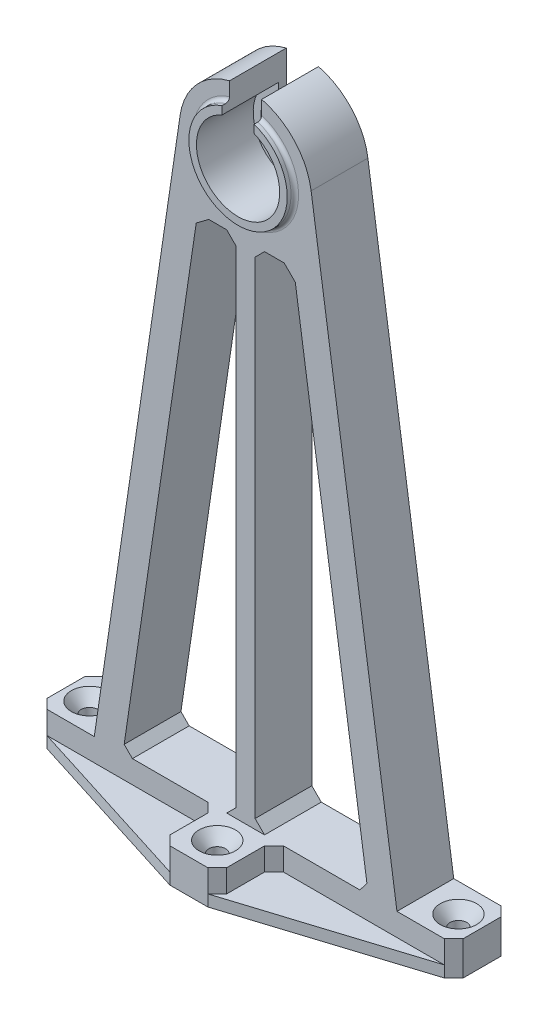
from build123d import *
from OCP.BRepFilletAPI import BRepFilletAPI_MakeChamfer

# Parameters (mm, degrees)
BOSS_EXTRUDE1_DEPTH     = 15
SKETCH4_W               = 15
SKETCH4_H               = 15
BOSS_EXTRUDE2_DEPTH     = 9
CUT_EXTRUDE1_DEPTH      = 180.279015807
CUT_EXTRUDE1_DEPTH_BACK = 180.279015807
SKETCH2_R               = 2.2
SKETCH3_W               = 4.807860213
SKETCH3_H               = 184.008472667
CHAMFER1_SIZE           = 2.5
CHAMFER1_SIZE2          = 2.965251078
CHAMFER1_SIZE2_2        = 2.201823595
CHAMFER2_SIZE           = 2.5
BOSS_EXTRUDE5_DEPTH     = 3
BOSS_EXTRUDE3_DEPTH     = 2
BOSS_EXTRUDE6_DEPTH     = 2
FILLET2_R               = 1


with BuildPart() as part:
    # Sketch1 → Boss-Extrude1 (new body)
    with BuildSketch(Plane.XY):
        with BuildLine():
            Line((4.25, 16.976086121), (4.25, 10.145811944))
            ThreePointArc((4.25, 10.145811944), (0, -11), (-4.25, 10.145811944))
            Line((-4.25, 10.145811944), (-4.25, 16.976086121))
            ThreePointArc((-4.25, 16.976086121), (-12.969277239, 11.74937649), (-17.312062276, 2.557831066))
            Line((-17.312062276, 2.557831066), (-40, -151))
            Line((-40, -151), (-55, -151))
            Line((-55, -151), (-55, -160))
            Line((-55, -160), (55, -160))
            Line((55, -160), (55, -151))
            Line((55, -151), (40, -151))
            Line((40, -151), (17.312062276, 2.557831066))
            ThreePointArc((17.312062276, 2.557831066), (12.969277239, 11.74937649), (4.25, 16.976086121))
        make_face()
        Polygon((12.694157412, -17.5), (32.418580877, -151), (2.5, -151), (2.5, -17.5), align=None, mode=Mode.SUBTRACT)
        Polygon((-12.694157412, -17.5), (-2.5, -17.5), (-2.5, -151), (-32.418580877, -151), align=None, mode=Mode.SUBTRACT)
    extrude(amount=BOSS_EXTRUDE1_DEPTH)

    # Sketch4 → Boss-Extrude2 (add)
    with BuildSketch(Plane.XZ.offset(160)):
        with Locations((0, 22.5)):
            Rectangle(SKETCH4_W, SKETCH4_H)
    extrude(amount=-BOSS_EXTRUDE2_DEPTH)

    # Sketch2 → Cut-Extrude1 (cut, two sides: drawn at the far end of the back side and taken through both)
    with BuildSketch(Plane(origin=(0, -151, 0), x_dir=(1, 0, 0), z_dir=(0, 1, 0)).offset(-CUT_EXTRUDE1_DEPTH_BACK)):
        with Locations(Location((-48.75, -7.5, 0), (0, 0, 180))):
            Circle(SKETCH2_R)
        with Locations(Location((48.75, -7.5, 0), (0, 0, 270))):
            Circle(SKETCH2_R)
        with Locations(Location((0, -22.5, 0), (0, 0, 180))):
            Circle(SKETCH2_R)
    extrude(amount=CUT_EXTRUDE1_DEPTH + CUT_EXTRUDE1_DEPTH_BACK, mode=Mode.SUBTRACT)

    # Sketch3 → Cut-Revolve2 (revolve, cut)
    with BuildSketch(Plane(origin=(-48.75, 0, 0), x_dir=(0, 0, -1), z_dir=(1, 0, 0)), mode=Mode.PRIVATE) as cut_revolve2_sk:
        with Locations((-5.096069894, -58.995763666)):
            Rectangle(SKETCH3_W, SKETCH3_H)
        Polygon((-5.3, -154), (-2.692139787, -151), (-7.5, -151), (-7.5, -154), align=None)
    cut_revolve2 = revolve(cut_revolve2_sk.sketch.rotate(Axis((-48.75, -151, 7.5), (0, -1, 0)), 270), axis=Axis((-48.75, -151, 7.5), (0, -1, 0)), mode=Mode.SUBTRACT)

    # Sketch5 → Cut-Revolve3 (revolve, cut)
    with BuildSketch(Plane(origin=(0, 0, 0), x_dir=(0, 0, -1), z_dir=(1, 0, 0)), mode=Mode.PRIVATE) as cut_revolve3_sk:
        Polygon((-22.5, -151), (-22.5, -154), (-20.3, -154), (-17.692139787, -151), align=None)
    revolve(cut_revolve3_sk.sketch.rotate(Axis((0, -151, 22.5), (0, -1, 0)), 270), axis=Axis((0, -151, 22.5), (0, -1, 0)), mode=Mode.SUBTRACT)

    # Mirror1: Cut-Revolve2 across plane
    add(cut_revolve2.mirror(Plane(origin=(0, 0, 0), x_dir=(0, 0, 1), z_dir=(1, 0, 0))), mode=Mode.SUBTRACT)

    # Chamfer1: one chamfer whose edges measure the first distance from different faces: ONE call of the kernel's chamfer builder (chamfer() names one face for all edges)
    chamfer1_edges_1 = [part.edges().sort_by_distance(p)[0] for p in [
        (-2.5, -17.5, 7.5),
        (-2.5, -151, 7.5),
        (2.5, -151, 7.5),
        (2.5, -17.5, 7.5),
    ]]
    chamfer1_edges_2 = [part.edges().sort_by_distance(p)[0] for p in [
        (-12.694157412, -17.5, 7.5),
    ]]
    chamfer1_side_2 = [part.faces().sort_by_distance(p)[0] for p in [
        (-22.556369145, -84.25, 7.5),
    ]]
    chamfer1_edges_3 = [part.edges().sort_by_distance(p)[0] for p in [
        (-32.418580877, -151, 7.5),
    ]]
    chamfer1_side_3 = [part.faces().sort_by_distance(p)[0] for p in [
        (31.704168003, -151, 7.5),
    ]]
    chamfer1_edges_4 = [part.edges().sort_by_distance(p)[0] for p in [
        (32.418580877, -151, 7.5),
    ]]
    chamfer1_side_4 = [part.faces().sort_by_distance(p)[0] for p in [
        (22.556369145, -84.25, 7.5),
    ]]
    chamfer1_edges_5 = [part.edges().sort_by_distance(p)[0] for p in [
        (12.694157412, -17.5, 7.5),
    ]]
    chamfer1_side_5 = [part.faces().sort_by_distance(p)[0] for p in [
        (7.597078706, -17.5, 7.5),
    ]]
    chamfer1 = BRepFilletAPI_MakeChamfer(part.part.solid().wrapped)
    for e in chamfer1_edges_1:
        chamfer1.Add(CHAMFER1_SIZE, e.wrapped)
    for e in chamfer1_edges_2:
        chamfer1.Add(CHAMFER1_SIZE, CHAMFER1_SIZE2, e.wrapped, chamfer1_side_2[0].wrapped)  # the first distance lies on this face
    for e in chamfer1_edges_3:
        chamfer1.Add(CHAMFER1_SIZE, CHAMFER1_SIZE2_2, e.wrapped, chamfer1_side_3[0].wrapped)  # the first distance lies on this face
    for e in chamfer1_edges_4:
        chamfer1.Add(CHAMFER1_SIZE, CHAMFER1_SIZE2_2, e.wrapped, chamfer1_side_4[0].wrapped)  # the first distance lies on this face
    for e in chamfer1_edges_5:
        chamfer1.Add(CHAMFER1_SIZE, CHAMFER1_SIZE2, e.wrapped, chamfer1_side_5[0].wrapped)  # the first distance lies on this face
    add(Compound.cast(chamfer1.Shape()), mode=Mode.REPLACE)

    # Chamfer2
    chamfer2_edges = [part.edges().sort_by_distance(p)[0] for p in [
        (55, -155.5, 0),
        (-55, -155.5, 0),
        (-55, -155.5, 15),
        (55, -155.5, 15),
        (7.5, -155.5, 15),
        (7.5, -155.5, 30),
        (-7.5, -155.5, 30),
        (-7.5, -155.5, 15),
    ]]
    chamfer(chamfer2_edges, length=CHAMFER2_SIZE)

    # Sketch7 → Boss-Extrude5 (add)
    with BuildSketch(Plane.XZ.offset(160)):
        Polygon((-5, 30), (-52.5, 15), (-10, 15), (-7.5, 17.5), (-7.5, 27.5), align=None)
        Polygon((52.5, 15), (5, 30), (7.5, 27.5), (7.5, 17.5), (10, 15), align=None)
    extrude(amount=-BOSS_EXTRUDE5_DEPTH)

    # Sketch6 → Boss-Extrude3 (add)
    with BuildSketch(Plane(origin=(0, 0, 0), x_dir=(-1, 0, 0), z_dir=(0, 0, -1))):
        with BuildLine():
            Line((-4.25, 7.933315826), (-4.25, 10.145811944))
            ThreePointArc((-4.25, 10.145811944), (-6.093028803, -9.158329542), (11, 0))
            ThreePointArc((11, 0), (9.158329542, 6.093028803), (4.25, 10.145811944))
            Line((4.25, 10.145811944), (4.25, 7.933315826))
            ThreePointArc((4.25, 7.933315826), (7.721722606, 4.623310502), (9, 0))
            ThreePointArc((9, 0), (-4.623310502, -7.721722606), (-4.25, 7.933315826))
        make_face()
    extrude(amount=-BOSS_EXTRUDE3_DEPTH)

    # Sketch9 → Boss-Extrude6 (add)
    with BuildSketch(Plane.XY.offset(15)):
        with BuildLine():
            ThreePointArc((-4.25, 12.285662375), (-7.541551564, -10.588909292), (13, 0))
            ThreePointArc((13, 0), (10.588909292, 7.541551564), (4.25, 12.285662375))
            Line((4.25, 12.285662375), (4.25, 10.145811944))
            ThreePointArc((4.25, 10.145811944), (0, -11), (-4.25, 10.145811944))
            Line((-4.25, 10.145811944), (-4.25, 12.285662375))
        make_face()
    extrude(amount=BOSS_EXTRUDE6_DEPTH)

    # Fillet2
    fillet2_edges = [part.edges().sort_by_distance(p)[0] for p in [
        (-7.541551564, -10.588909292, 15),
    ]]
    fillet(fillet2_edges, radius=FILLET2_R)


solid = part.part
